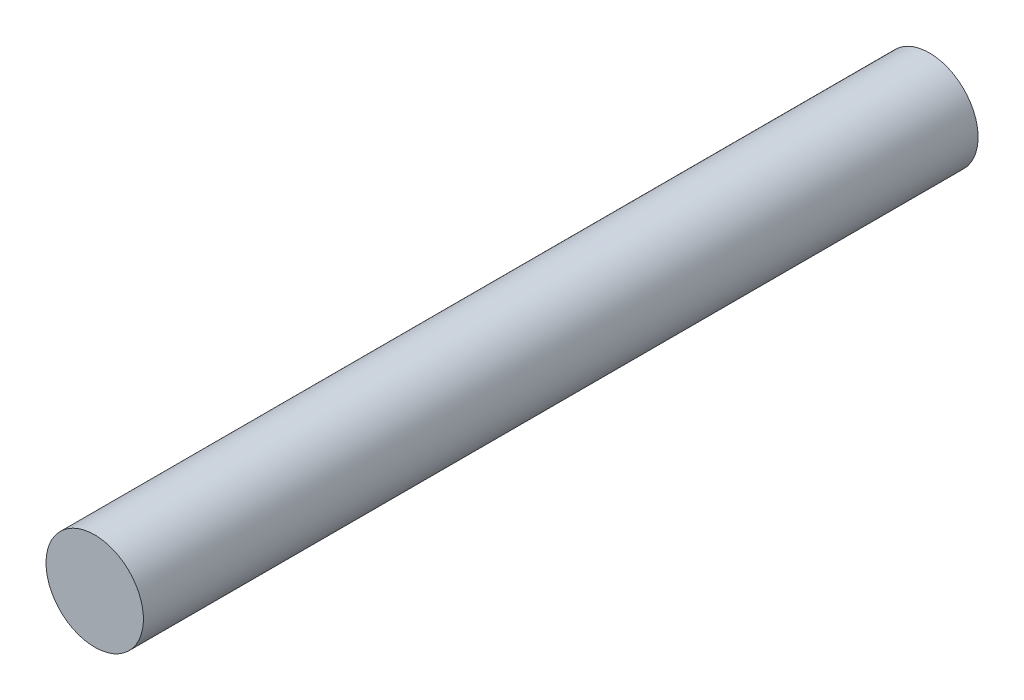
from build123d import *

# Parameters (mm, degrees)
SKETCH1_R           = 2.2225
BOSS_EXTRUDE1_DEPTH = 38.1


with BuildPart() as part:
    # Sketch1 → Boss-Extrude1 (new body)
    with BuildSketch(Plane.XY):
        with Locations(Location((0, 0, 0), (0, 0, 180))):
            Circle(SKETCH1_R)
    extrude(amount=BOSS_EXTRUDE1_DEPTH)


solid = part.part
